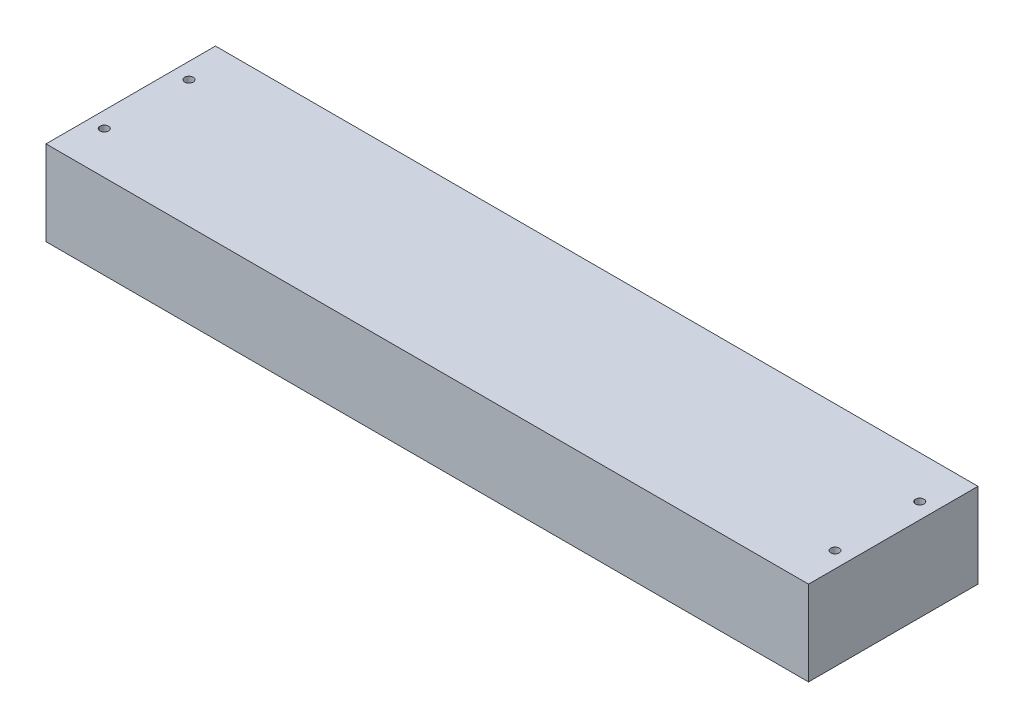
from build123d import *

# Parameters (mm, degrees)
SKETCH1_W           = 101.6
SKETCH1_H           = 50.8
BOSS_EXTRUDE1_DEPTH = 457.2
SKETCH3_R           = 2.5527
CUT_EXTRUDE1_DEPTH  = 50.8


with BuildPart() as part:
    # Sketch1 → Boss-Extrude1 (new body)
    with BuildSketch(Plane(origin=(0, 0, 0), x_dir=(0, 0, -1), z_dir=(1, 0, 0))):
        Rectangle(SKETCH1_W, SKETCH1_H)
    extrude(amount=BOSS_EXTRUDE1_DEPTH)

    # Sketch3 → Cut-Extrude1 (cut)
    with BuildSketch(Plane(origin=(0, 25.4, 0), x_dir=(1, 0, 0), z_dir=(0, 1, 0))):
        with Locations(Location((9.525, 25.4, 0), (0, 0, 270))):
            Circle(SKETCH3_R)
        with Locations(Location((9.525, -25.4, 0), (0, 0, 270))):
            Circle(SKETCH3_R)
    cut_extrude1 = extrude(amount=-CUT_EXTRUDE1_DEPTH, mode=Mode.SUBTRACT)

    # Mirror1: Cut-Extrude1 across plane
    add(cut_extrude1.mirror(Plane.ZY.offset(-228.6)), mode=Mode.SUBTRACT)


solid = part.part
